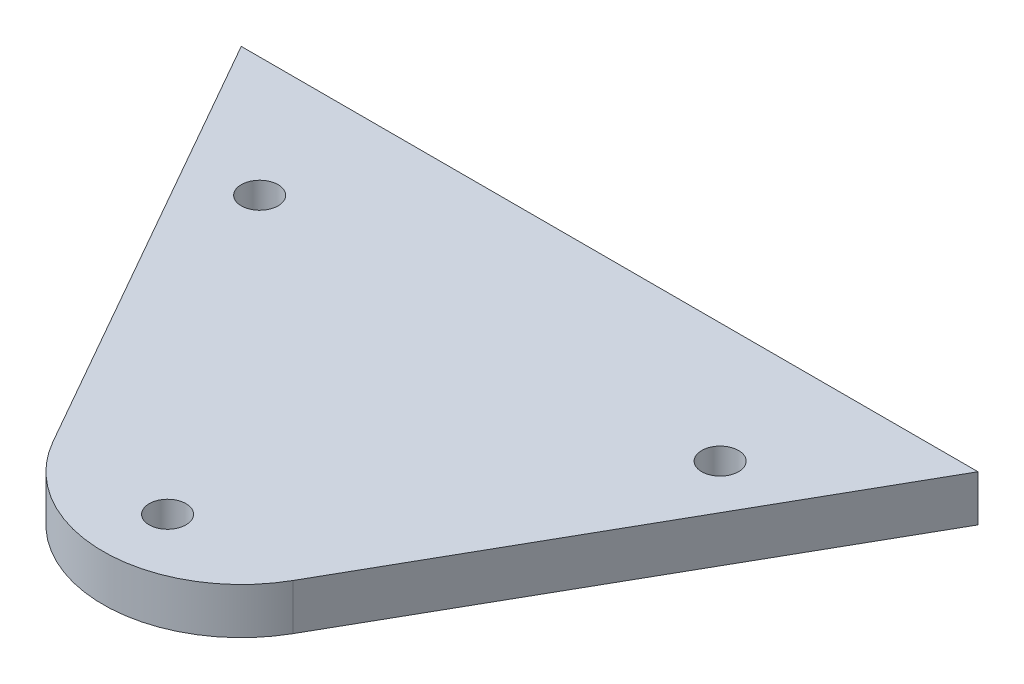
from build123d import *

# Parameters (mm, degrees)
BOSS_EXTRUDE1_DEPTH = 5
CUT_EXTRUDE1_REACH  = 64.682
SKETCH2_R           = 2
CUT_EXTRUDE2_REACH  = 64.682
SKETCH3_R           = 2


with BuildPart() as part:
    # Sketch1 → Boss-Extrude1 (new body)
    with BuildSketch(Plane(origin=(0, 0, 0), x_dir=(1, 0, 0), z_dir=(0, 1, 0))):
        with BuildLine():
            Line((40, 48), (-40, 48))
            Line((-40, 48), (-13.039417607, 0.585582393))
            ThreePointArc((-13.039417607, 0.585582393), (0, -7), (13.039417607, 0.585582393))
            Line((13.039417607, 0.585582393), (40, 48))
        make_face()
    extrude(amount=BOSS_EXTRUDE1_DEPTH)

    # Sketch2 → Cut-Extrude1 (cut, up to next)
    with BuildSketch(Plane(origin=(0, 5, 0), x_dir=(1, 0, 0), z_dir=(0, 1, 0)), mode=Mode.PRIVATE) as cut_extrude1_sk1:
        with Locations(Location((-25, 35, 0), (0, 0, 270))):
            Circle(SKETCH2_R)
    cut_extrude1_tool1 = extrude(cut_extrude1_sk1.sketch, amount=-CUT_EXTRUDE1_REACH, mode=Mode.PRIVATE) & part.part
    cut_extrude1 = cut_extrude1_tool1.solids().sort_by_distance((-25, 5, -35))[0]
    add(cut_extrude1, mode=Mode.SUBTRACT)

    # Mirror1: Cut-Extrude1 across plane
    add(cut_extrude1.mirror(Plane(origin=(0, 0, 0), x_dir=(0, 0, 1), z_dir=(1, 0, 0))), mode=Mode.SUBTRACT)

    # Sketch3 → Cut-Extrude2 (cut, up to next)
    with BuildSketch(Plane(origin=(0, 5, 0), x_dir=(1, 0, 0), z_dir=(0, 1, 0)), mode=Mode.PRIVATE) as cut_extrude2_sk1:
        with Locations(Location((0, 0, 0), (0, 0, 270))):
            Circle(SKETCH3_R)
    cut_extrude2_tool1 = extrude(cut_extrude2_sk1.sketch, amount=-CUT_EXTRUDE2_REACH, mode=Mode.PRIVATE) & part.part
    add(cut_extrude2_tool1.solids().sort_by_distance((0, 5, 0))[0], mode=Mode.SUBTRACT)


solid = part.part
